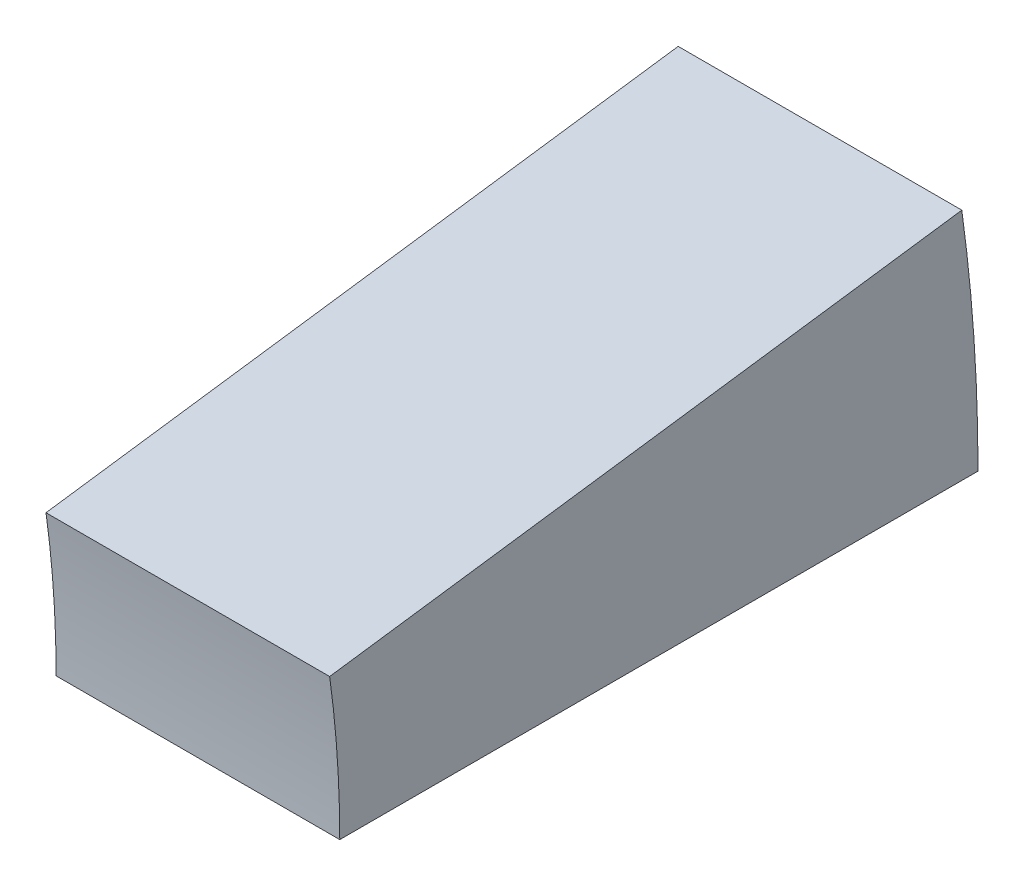
from build123d import *

# Parameters (mm, degrees)
CROQUIS1_W              = 24
CROQUIS1_H              = 144
SALIENTE_EXTRUIR1_DEPTH = 20
CORTAR_EXTRUIR2_DEPTH   = 148.349923651
CROQUIS7_W              = 24
CROQUIS7_H              = 40.261393694
CROQUIS4_W              = 24
CROQUIS4_H              = 90


with BuildPart() as part:
    # Croquis1 → Saliente-Extruir1 (new body)
    with BuildSketch(Plane(origin=(0, 0, 0), x_dir=(1, 0, 0), z_dir=(0, 1, 0))):
        with Locations((12, 72)):
            Rectangle(CROQUIS1_W, CROQUIS1_H)
    extrude(amount=SALIENTE_EXTRUIR1_DEPTH)

    # Croquis3 → Cortar-Extruir2 (cut, through all)
    with BuildSketch(Plane(origin=(24, 0, 0), x_dir=(0, 0, -1), z_dir=(1, 0, 0))):
        Polygon((144, 20), (0, 0), (0, 20), align=None)
    extrude(amount=-CORTAR_EXTRUIR2_DEPTH, mode=Mode.SUBTRACT)

    # Croquis7 → Cortar-Revolución5 (revolve, cut)
    with BuildSketch(Plane.XZ):
        with Locations((12, -164.130696847)):
            Rectangle(CROQUIS7_W, CROQUIS7_H)
    revolve(axis=Axis((0, 0, 0), (1, 0, 0)), mode=Mode.SUBTRACT)

    # Croquis4 → Cortar-Revolución3 (revolve, cut)
    with BuildSketch(Plane.XZ):
        with Locations((12, -45)):
            Rectangle(CROQUIS4_W, CROQUIS4_H)
    revolve(axis=Axis((24, 0, 0), (-1, 0, 0)), mode=Mode.SUBTRACT)


solid = part.part
